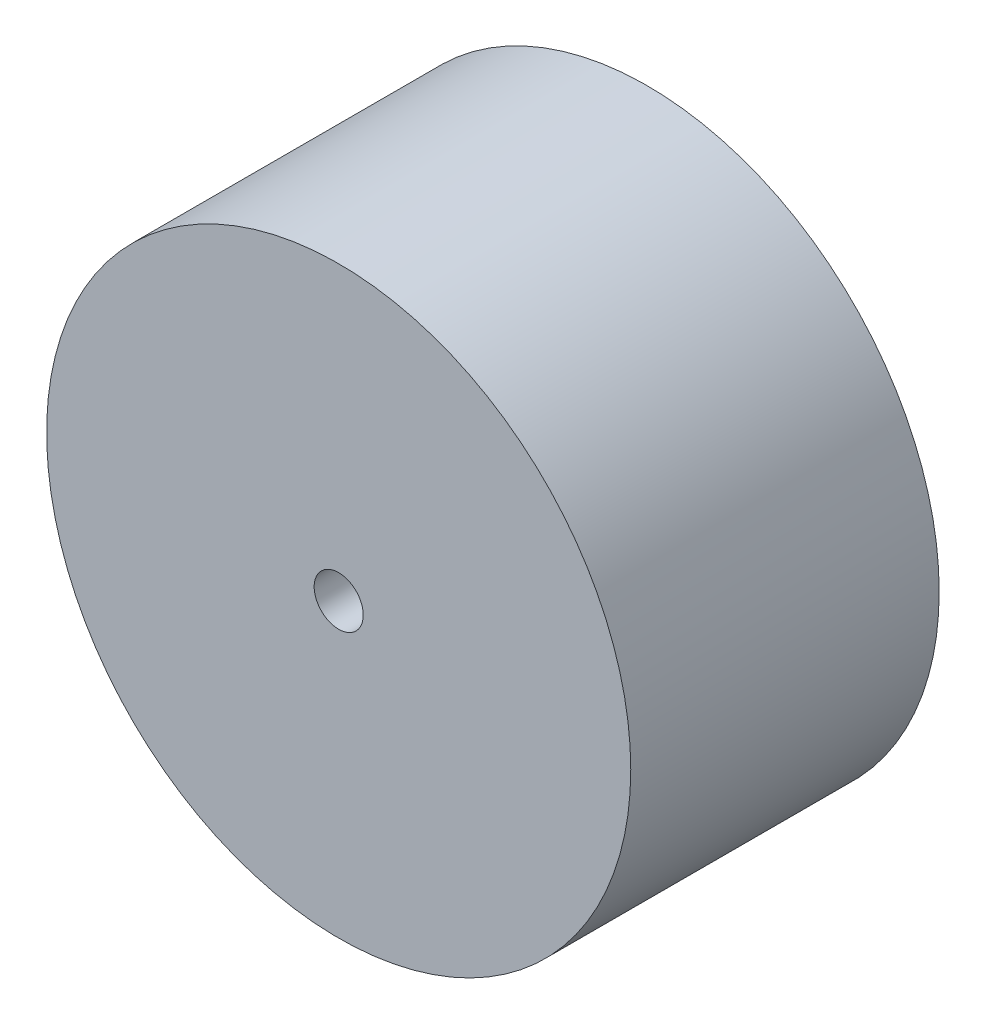
from build123d import *

# Parameters (mm, degrees)
SKETCH1_R                       = 25
BOSS_EXTRUDE1_DEPTH             = 13.2
TAP_DRILL_FOR_M5X0_8_TAP1_D     = 4.2
TAP_DRILL_FOR_M5X0_8_TAP1_DEPTH = 6.35
TAP_DRILL_FOR_M5X0_8_TAP1_TIP   = 1.2618073


with BuildPart() as part:
    # Sketch1 → Boss-Extrude1 (new, symmetric)
    with BuildSketch(Plane.XY):
        Circle(SKETCH1_R)
    extrude(amount=BOSS_EXTRUDE1_DEPTH, both=True)

    # Tap Drill for M5x0.8 Tap1
    with Locations(Plane.XY.offset(13.2)):
        with Locations((0, 0)):
            Hole(TAP_DRILL_FOR_M5X0_8_TAP1_D / 2, depth=TAP_DRILL_FOR_M5X0_8_TAP1_DEPTH)
            with Locations((0, 0, -(TAP_DRILL_FOR_M5X0_8_TAP1_DEPTH + TAP_DRILL_FOR_M5X0_8_TAP1_TIP / 2))):  # 118° drill point
                Cone(0, TAP_DRILL_FOR_M5X0_8_TAP1_D / 2, TAP_DRILL_FOR_M5X0_8_TAP1_TIP, mode=Mode.SUBTRACT)


solid = part.part
